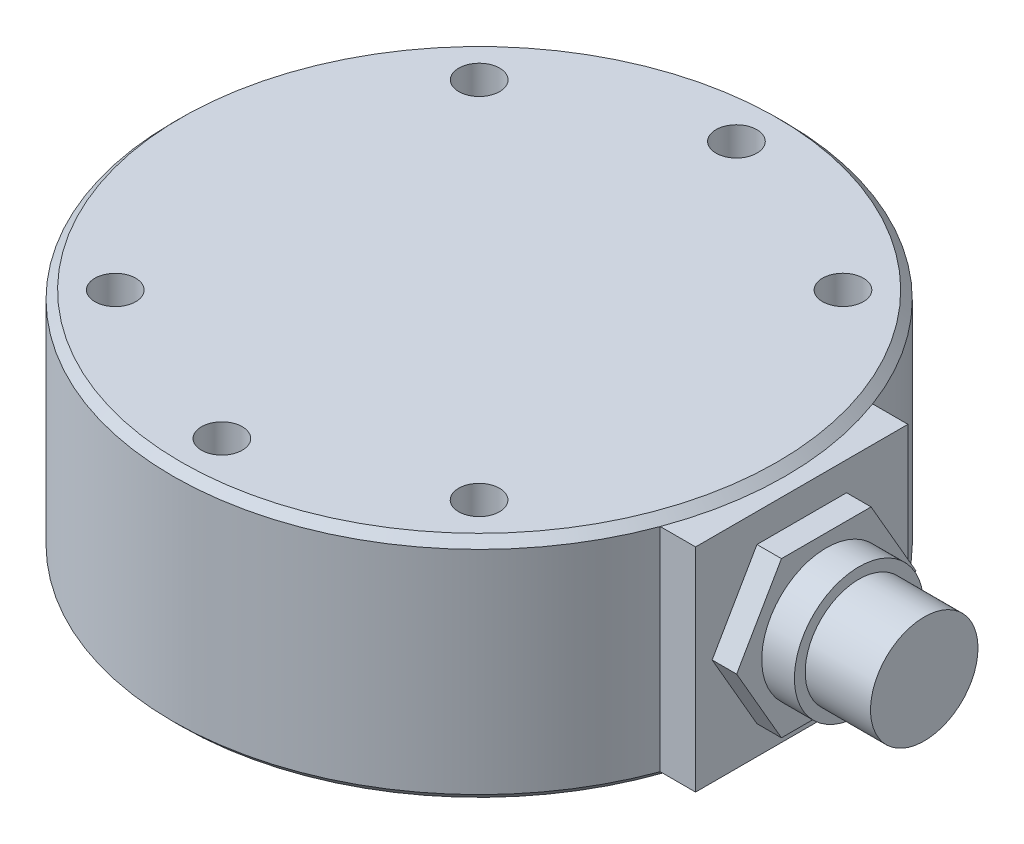
from build123d import *

# Parameters (mm, degrees)
SKETCH1_R           = 37.5
BOSS_EXTRUDE1_DEPTH = 28
CHAMFER1_SIZE       = 1
BOSS_EXTRUDE2_REACH = 92.107
SKETCH2_W           = 26
SKETCH2_H           = 26
BOSS_EXTRUDE3_DEPTH = 3
SKETCH4_R           = 7.9
BOSS_EXTRUDE4_DEPTH = 4
SKETCH5_R           = 6.58
BOSS_EXTRUDE5_DEPTH = 8
SKETCH6_R           = 2.5
CUT_EXTRUDE1_DEPTH  = 5


with BuildPart() as part:
    # Sketch1 → Boss-Extrude1 (new body)
    with BuildSketch(Plane(origin=(0, 0, 0), x_dir=(1, 0, 0), z_dir=(0, 1, 0))):
        with Locations(Location((0, 0, 0), (0, 0, 270))):
            Circle(SKETCH1_R)
    extrude(amount=BOSS_EXTRUDE1_DEPTH)

    # Chamfer1
    chamfer1_edges = [part.edges().sort_by_distance(p)[0] for p in [
        (0, 0, -37.5),
        (0, 28, -37.5),
    ]]
    chamfer(chamfer1_edges, length=CHAMFER1_SIZE)

    # Sketch2 → Boss-Extrude2 (add, up to next)
    with BuildSketch(Plane(origin=(39.5, 0, 0), x_dir=(0, 0, -1), z_dir=(1, 0, 0)), mode=Mode.PRIVATE) as boss_extrude2_sk1:
        with Locations((0, 14)):
            Rectangle(SKETCH2_W, SKETCH2_H)
    boss_extrude2_tool1 = extrude(boss_extrude2_sk1.sketch, amount=-BOSS_EXTRUDE2_REACH, mode=Mode.PRIVATE) - part.part
    add(boss_extrude2_tool1.solids().sort_by_distance((39.5, 14, 0))[0])

    # Sketch3 → Boss-Extrude3 (add)
    with BuildSketch(Plane(origin=(39.5, 0, 0), x_dir=(0, 0, -1), z_dir=(1, 0, 0))):
        Polygon((10.97, 14), (5.485, 23.50029868), (-5.485, 23.50029868), (-10.97, 14), (-5.485, 4.49970132), (5.485, 4.49970132), align=None)
    extrude(amount=BOSS_EXTRUDE3_DEPTH)

    # Sketch4 → Boss-Extrude4 (add)
    with BuildSketch(Plane(origin=(42.5, 0, 0), x_dir=(0, 0, -1), z_dir=(1, 0, 0))):
        with Locations((0, 14)):
            Circle(SKETCH4_R)
    extrude(amount=BOSS_EXTRUDE4_DEPTH)

    # Sketch5 → Boss-Extrude5 (add)
    with BuildSketch(Plane(origin=(46.5, 0, 0), x_dir=(0, 0, -1), z_dir=(1, 0, 0))):
        with Locations((0, 14)):
            Circle(SKETCH5_R)
    extrude(amount=BOSS_EXTRUDE5_DEPTH)

    # Sketch6 → Cut-Extrude1 (cut)
    with BuildSketch(Plane(origin=(0, 28, 0), x_dir=(1, 0, 0), z_dir=(0, 1, 0))):
        with Locations(Location((0, 31.5, 0), (0, 0, 270))):
            Circle(SKETCH6_R)
        with Locations(Location((0, -31.5, 0), (0, 0, 270))):
            Circle(SKETCH6_R)
        with Locations(Location((22.27, -22.277726545, 0), (0, 0, 270))):
            Circle(SKETCH6_R)
        with Locations(Location((-22.27, -22.277726545, 0), (0, 0, 270))):
            Circle(SKETCH6_R)
        with Locations(Location((-22.27, 22.277726545, 0), (0, 0, 270))):
            Circle(SKETCH6_R)
        with Locations(Location((22.27, 22.277726545, 0), (0, 0, 270))):
            Circle(SKETCH6_R)
    extrude(amount=-CUT_EXTRUDE1_DEPTH, mode=Mode.SUBTRACT)


solid = part.part
